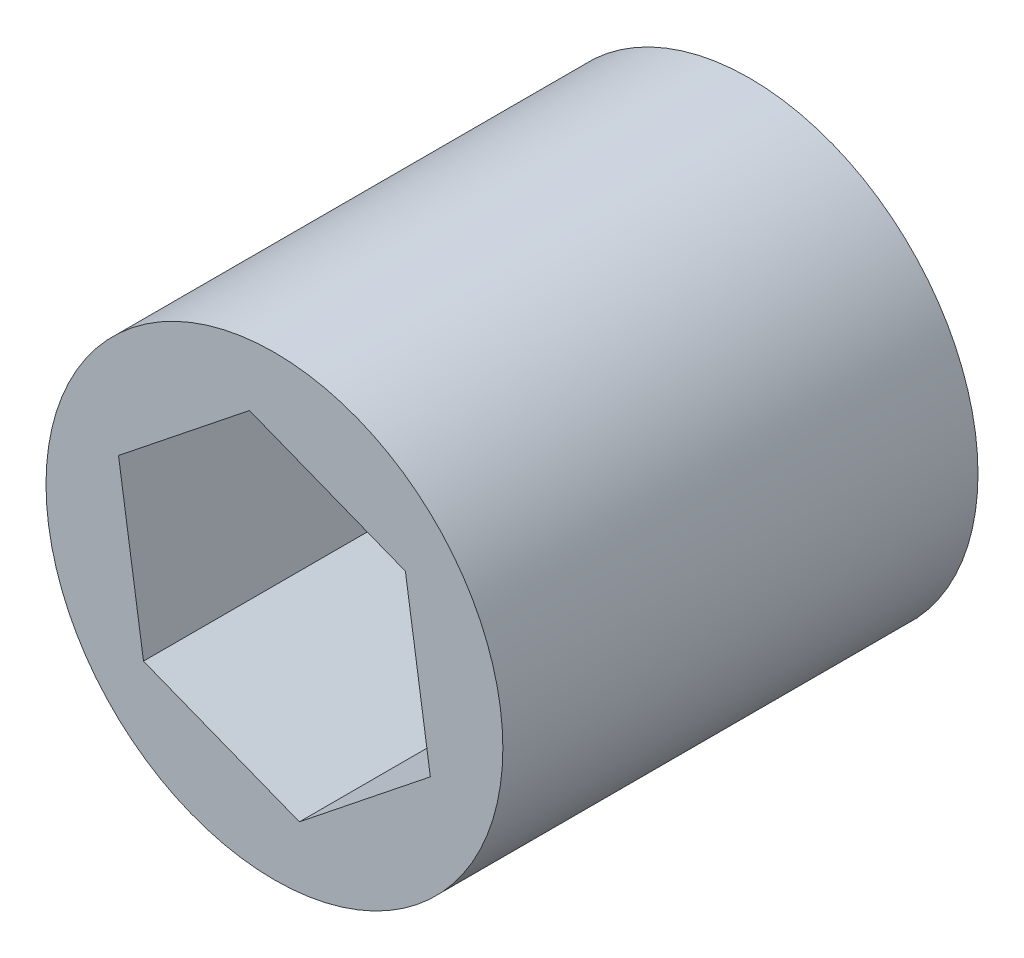
from build123d import *

# Parameters (mm, degrees)
SKETCH1_R           = 10
BOSS_EXTRUDE1_DEPTH = 20.8


with BuildPart() as part:
    # Sketch1 → Boss-Extrude1 (new body)
    with BuildSketch(Plane.XY):
        Circle(SKETCH1_R)
        Polygon((-6.82564389, 2.678417223), (-5.732399302, -4.571972395), (1.093244588, -7.250389617), (6.82564389, -2.678417223), (5.732399302, 4.571972395), (-1.093244588, 7.250389617), align=None, mode=Mode.SUBTRACT)
    extrude(amount=BOSS_EXTRUDE1_DEPTH)


solid = part.part
